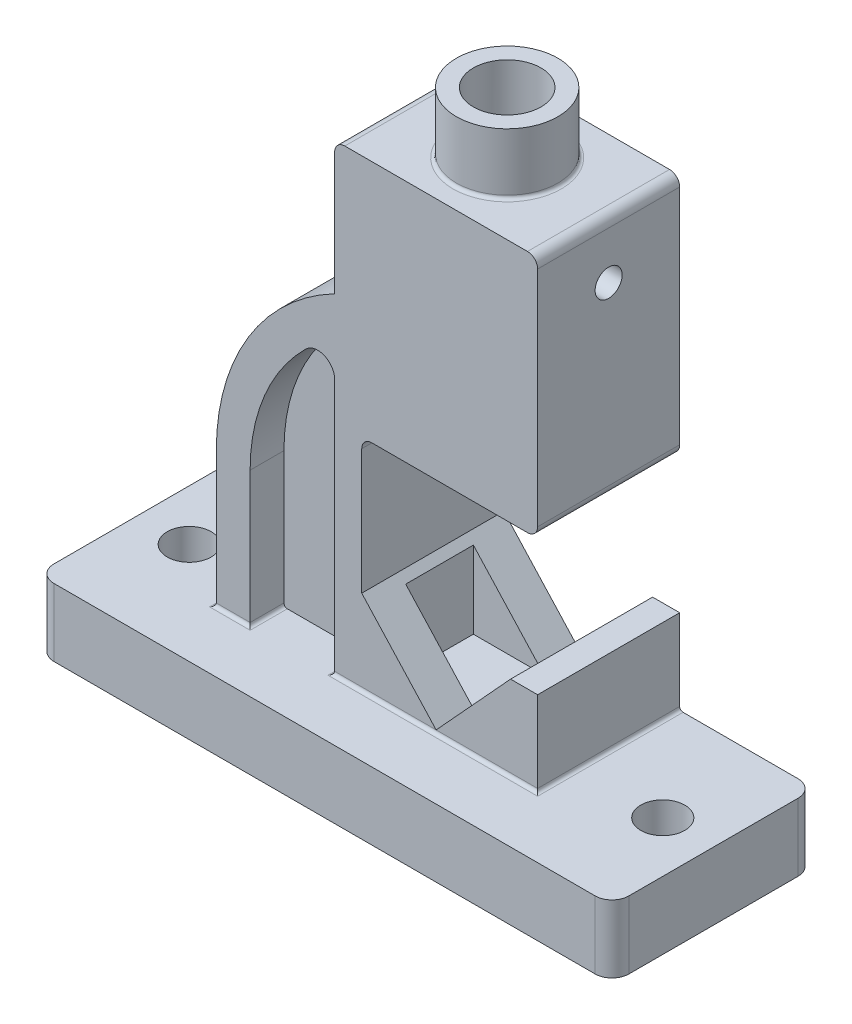
from build123d import *

# Parameters (mm, degrees)
SKETCH1_R               = 6.5
BOSS_EXTRUDE1_DEPTH     = 20
BOSS_EXTRUDE2_DEPTH     = 42
SKETCH4_W               = 40
SKETCH4_H               = 20
CUT_EXTRUDE1_DEPTH      = 25
BOSS_EXTRUDE3_DEPTH     = 11
FILLET1_R               = 3
SKETCH7_R               = 15
SKETCH7_R_2             = 10
BOSS_EXTRUDE4_DEPTH     = 18
FILLET2_R               = 1
CUT_EXTRUDE2_START      = -94
SKETCH8_R               = 10
CUT_EXTRUDE2_DEPTH      = 94
CUT_EXTRUDE3_DEPTH      = 199.421269084
CUT_EXTRUDE3_DEPTH_BACK = 199.421269084
SKETCH9_R               = 4


with BuildPart() as part:
    # Sketch1 → Boss-Extrude1 (new body)
    with BuildSketch(Plane(origin=(0, 0, 0), x_dir=(1, 0, 0), z_dir=(0, 1, 0))):
        with BuildLine():
            Line((80, -30), (-80, -30))
            ThreePointArc((-80, -30), (-83.535533906, -28.535533906), (-85, -25))
            Line((-85, -25), (-85, 25))
            ThreePointArc((-85, 25), (-83.535533906, 28.535533906), (-80, 30))
            Line((-80, 30), (80, 30))
            ThreePointArc((80, 30), (83.535533906, 28.535533906), (85, 25))
            Line((85, 25), (85, -25))
            ThreePointArc((85, -25), (83.535533906, -28.535533906), (80, -30))
        make_face()
        with Locations(Location((-70, 0, 0), (0, 0, 270))):
            Circle(SKETCH1_R, mode=Mode.SUBTRACT)
        with Locations(Location((70, 0, 0), (0, 0, 90))):
            Circle(SKETCH1_R, mode=Mode.SUBTRACT)
    extrude(amount=BOSS_EXTRUDE1_DEPTH)

    # Sketch2 → Boss-Extrude2 (add)
    with BuildSketch(Plane.XY.offset(12)):
        with BuildLine():
            Line((15, 20.991212976), (-7, 45))
            Line((-7, 45), (-7, 85))
            Line((-7, 85), (45, 85))
            Line((45, 85), (45, 157))
            Line((45, 157), (-15, 157))
            Line((-15, 157), (-15, 117.662812973))
            ThreePointArc((-15, 117.662812973), (-40.565276927, 93.726843908), (-50, 60))
            Line((-50, 60), (-50, 20))
            Line((-50, 20), (-40, 20))
            Line((-40, 20), (-40, 60))
            ThreePointArc((-40, 60), (-35.707494515, 81.301408404), (-23.5, 99.277856357))
            ThreePointArc((-23.5, 99.277856357), (-18.063508327, 100.316914371), (-15, 95.707142143))
            Line((-15, 95.707142143), (-15, 20))
            Line((-15, 20), (45, 20))
            Line((45, 20), (45, 45))
            Line((45, 45), (37, 45))
            Line((37, 45), (15, 20.991212976))
        make_face()
    extrude(amount=-BOSS_EXTRUDE2_DEPTH)

    # Sketch4 → Cut-Extrude1 (cut)
    with BuildSketch(Plane(origin=(0, 45, 0), x_dir=(1, 0, 0), z_dir=(0, 1, 0))):
        with Locations((15, 9)):
            Rectangle(SKETCH4_W, SKETCH4_H)
    extrude(amount=-CUT_EXTRUDE1_DEPTH, mode=Mode.SUBTRACT)

    # Sketch5 → Boss-Extrude3 (add, symmetric)
    with BuildSketch(Plane.XY.offset(-9)):
        with BuildLine():
            Line((-15, 20), (-15, 95.707142143))
            ThreePointArc((-15, 95.707142143), (-18.063508327, 100.316914371), (-23.5, 99.277856357))
            ThreePointArc((-23.5, 99.277856357), (-35.707494515, 81.301408404), (-40, 60))
            Line((-40, 60), (-40, 20))
            Line((-40, 20), (-15, 20))
        make_face()
    extrude(amount=BOSS_EXTRUDE3_DEPTH, both=True)

    # Fillet1
    fillet1_edges = [part.edges().sort_by_distance(p)[0] for p in [
        (-7, 85, -9),
        (45, 85, -9),
        (45, 157, -9),
        (-15, 157, -9),
    ]]
    fillet(fillet1_edges, radius=FILLET1_R)

    # Sketch7 → Boss-Extrude4 (add)
    with BuildSketch(Plane(origin=(0, 157, 0), x_dir=(1, 0, 0), z_dir=(0, 1, 0))):
        with Locations(Location((15, 9, 0), (0, 0, 270))):
            Circle(SKETCH7_R)
        with Locations(Location((15, 9, 0), (0, 0, 270))):
            Circle(SKETCH7_R_2, mode=Mode.SUBTRACT)
    extrude(amount=BOSS_EXTRUDE4_DEPTH)

    # Fillet2
    fillet2_edges = [part.edges().sort_by_distance(p)[0] for p in [
        (15, 157, -24),
        (45, 20, -9),
        (15, 20, 12),
        (-50, 20, -9),
        (-45, 20, 12),
        (-40, 20, 7),
        (-15, 20, 7),
    ]]
    fillet(fillet2_edges, radius=FILLET2_R)

    # Sketch8 → Cut-Extrude2 (cut)
    with BuildSketch(Plane(origin=(0, 157, 0), x_dir=(1, 0, 0), z_dir=(0, 1, 0)).offset(CUT_EXTRUDE2_START)):
        with Locations(Location((15, 9, 0), (0, 0, 90))):
            Circle(SKETCH8_R)
    extrude(amount=CUT_EXTRUDE2_DEPTH, mode=Mode.SUBTRACT)

    # Sketch9 → Cut-Extrude3 (cut, two sides: drawn at the far end of the back side and taken through both)
    with BuildSketch(Plane(origin=(0, 0, -9), x_dir=(0, 0, -1), z_dir=(1, 0, 0)).offset(-CUT_EXTRUDE3_DEPTH_BACK)):
        with Locations(Location((0, 140, 0), (0, 0, 180))):
            Circle(SKETCH9_R)
    extrude(amount=CUT_EXTRUDE3_DEPTH + CUT_EXTRUDE3_DEPTH_BACK, mode=Mode.SUBTRACT)


solid = part.part
